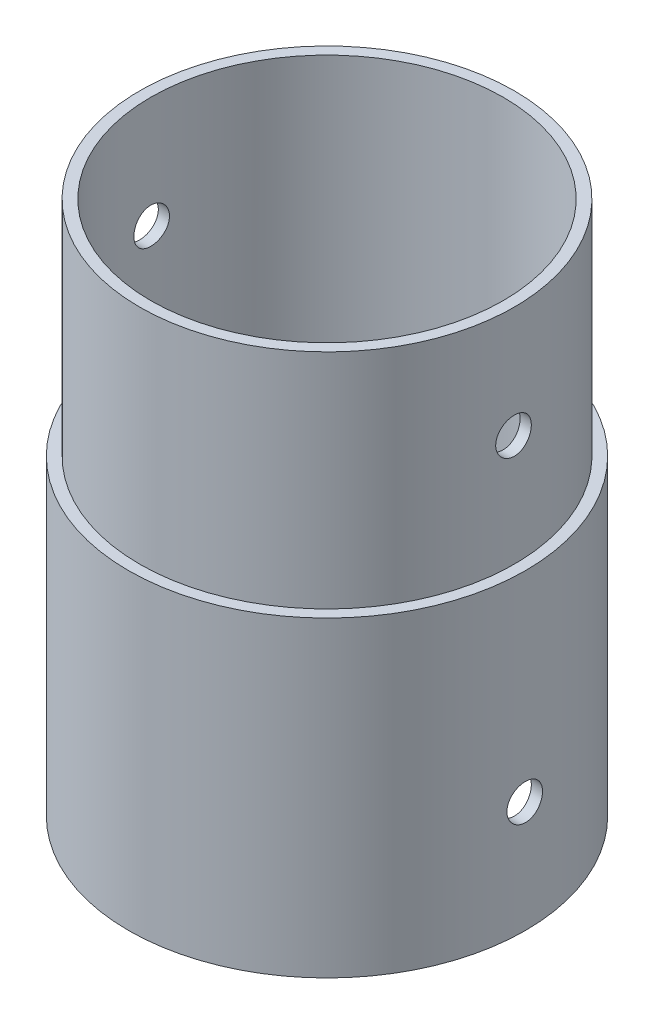
from build123d import *

# Parameters (mm, degrees)
SKETCH1_R               = 34
BOSS_EXTRUDE1_DEPTH     = 10
SKETCH2_R               = 19.7871926
SKETCH2_R_2             = 2
CUT_EXTRUDE1_DEPTH      = 10
SKETCH3_R               = 4.837531333
SKETCH4_W               = 4.837531333
SKETCH4_H               = 4.837531333
CUT_EXTRUDE3_DEPTH      = 38
CUT_EXTRUDE3_DEPTH_BACK = 38
SKETCH5_W               = 72.361656805
SKETCH5_H               = 8.896778435
BOSS_EXTRUDE2_START     = 60
SKETCH6_R               = 22.2871926
SKETCH6_R_2             = 19.7871926
BOSS_EXTRUDE2_DEPTH     = 60
SKETCH7_R               = 21.0371926
SKETCH7_R_2             = 19.7871926
CUT_EXTRUDE4_DEPTH      = 25
CUT_EXTRUDE6_DEPTH      = 25
CUT_EXTRUDE6_DEPTH_BACK = 25
SKETCH8_R               = 2
CUT_EXTRUDE7_DEPTH      = 43
CUT_EXTRUDE7_DEPTH_BACK = 53
SKETCH9_W               = 69.351432881
SKETCH9_H               = 5.737807944
CUT_EXTRUDE8_START      = -25
SKETCH10_R              = 22.2871926
SKETCH10_R_2            = 21.0371926
CUT_EXTRUDE8_DEPTH      = 25
CUT_EXTRUDE9_DEPTH      = 30
CUT_EXTRUDE9_DEPTH_BACK = 30
SKETCH11_R              = 2


with BuildPart() as part:
    # Sketch1 → Boss-Extrude1 (new body)
    with BuildSketch(Plane(origin=(0, 0, 0), x_dir=(1, 0, 0), z_dir=(0, 1, 0))):
        Circle(SKETCH1_R)
    extrude(amount=BOSS_EXTRUDE1_DEPTH)

    # Sketch2 → Cut-Extrude1 (cut)
    with BuildSketch(Plane.XZ):
        Circle(SKETCH2_R)
        with Locations((-22.1, 12.5)):
            Circle(SKETCH2_R_2)
        with Locations((22.1, 12.5)):
            Circle(SKETCH2_R_2)
        with Locations((22.1, -12.5)):
            Circle(SKETCH2_R_2)
        with Locations((-22.1, -12.5)):
            Circle(SKETCH2_R_2)
    extrude(amount=-CUT_EXTRUDE1_DEPTH, mode=Mode.SUBTRACT)

    # Sketch3 → Cut-Revolve1 (revolve, cut)
    with BuildSketch(Plane(origin=(0, 0, 0), x_dir=(0, 0, -1), z_dir=(1, 0, 0))):
        with Locations((-34, 5)):
            Circle(SKETCH3_R)
    revolve(axis=Axis((0, 0, 0), (0, 1, 0)), mode=Mode.SUBTRACT)

    # Sketch4 → Cut-Revolve2 (revolve, cut)
    with BuildSketch(Plane(origin=(0, 0, 0), x_dir=(0, 0, -1), z_dir=(1, 0, 0))):
        with Locations((-31.581234333, 2.581234333)):
            Rectangle(SKETCH4_W, SKETCH4_H)
    revolve(axis=Axis((0, 0, 0), (0, 1, 0)), mode=Mode.SUBTRACT)

    # Sketch5 → Cut-Extrude3 (cut, two sides: drawn at the far end of the back side and taken through both)
    with BuildSketch(Plane(origin=(0, 0, 0), x_dir=(0, 0, -1), z_dir=(1, 0, 0)).offset(-CUT_EXTRUDE3_DEPTH_BACK)):
        with Locations((-0.901301775, 0.551610782)):
            Rectangle(SKETCH5_W, SKETCH5_H)
    extrude(amount=CUT_EXTRUDE3_DEPTH + CUT_EXTRUDE3_DEPTH_BACK, mode=Mode.SUBTRACT)

    # Sketch6 → Boss-Extrude2 (add)
    with BuildSketch(Plane.XZ.offset(-5).offset(BOSS_EXTRUDE2_START)):
        Circle(SKETCH6_R)
        Circle(SKETCH6_R_2, mode=Mode.SUBTRACT)
    extrude(amount=-BOSS_EXTRUDE2_DEPTH)

    # Sketch7 → Cut-Extrude4 (cut)
    with BuildSketch(Plane.XZ.offset(55)):
        Circle(SKETCH7_R)
        Circle(SKETCH7_R_2, mode=Mode.SUBTRACT)
    extrude(amount=-CUT_EXTRUDE4_DEPTH, mode=Mode.SUBTRACT)

    # Sketch8 → Cut-Extrude6 (cut, two sides: drawn at the far end of the back side and taken through both)
    with BuildSketch(Plane(origin=(0, 0, 0), x_dir=(0, 0, -1), z_dir=(1, 0, 0)).offset(-CUT_EXTRUDE6_DEPTH_BACK)):
        with Locations((0, -42.5)):
            Circle(SKETCH8_R)
    extrude(amount=CUT_EXTRUDE6_DEPTH + CUT_EXTRUDE6_DEPTH_BACK, mode=Mode.SUBTRACT)

    # Sketch9 → Cut-Extrude7 (cut, two sides: drawn at the far end of the back side and taken through both)
    with BuildSketch(Plane(origin=(0, 0, 0), x_dir=(0, 0, -1), z_dir=(1, 0, 0)).offset(-CUT_EXTRUDE7_DEPTH_BACK)):
        with Locations((0.165912519, 7.868903972)):
            Rectangle(SKETCH9_W, SKETCH9_H)
    extrude(amount=CUT_EXTRUDE7_DEPTH + CUT_EXTRUDE7_DEPTH_BACK, mode=Mode.SUBTRACT)

    # Sketch10 → Cut-Extrude8 (cut)
    with BuildSketch(Plane(origin=(0, 5, 0), x_dir=(1, 0, 0), z_dir=(0, 1, 0)).offset(CUT_EXTRUDE8_START)):
        Circle(SKETCH10_R)
        Circle(SKETCH10_R_2, mode=Mode.SUBTRACT)
    extrude(amount=CUT_EXTRUDE8_DEPTH, mode=Mode.SUBTRACT)

    # Sketch11 → Cut-Extrude9 (cut, two sides: drawn at the far end of the back side and taken through both)
    with BuildSketch(Plane(origin=(0, 0, 0), x_dir=(0, 0, -1), z_dir=(1, 0, 0)).offset(-CUT_EXTRUDE9_DEPTH_BACK)):
        with Locations((0, -7.5)):
            Circle(SKETCH11_R)
    extrude(amount=CUT_EXTRUDE9_DEPTH + CUT_EXTRUDE9_DEPTH_BACK, mode=Mode.SUBTRACT)


solid = part.part
